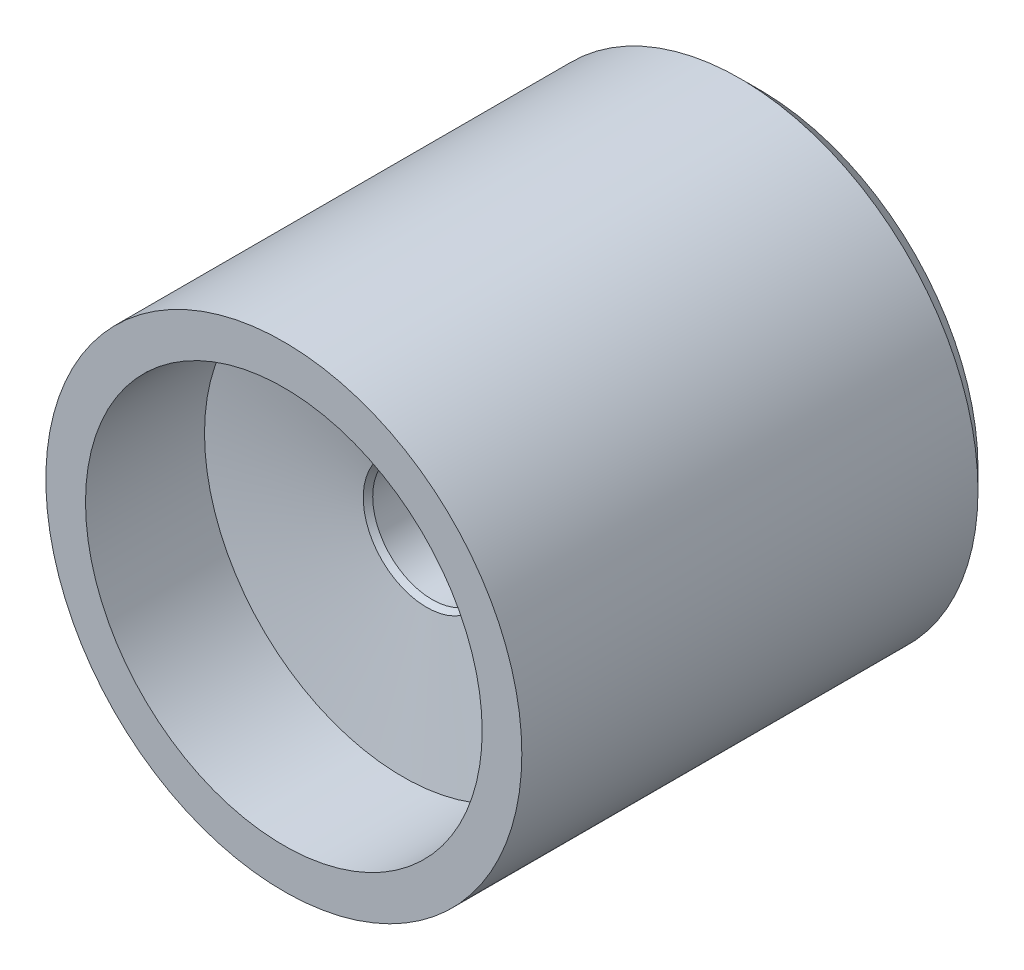
from build123d import *

# Parameters (mm, degrees)
SKETCH2_R           = 6
BOSS_EXTRUDE1_DEPTH = 12
CHAMFER1_SIZE       = 0.1
CHAMFER1_SIZE2      = 0.123280305
CHAMFER2_SIZE       = 0.5


with BuildPart() as part:
    # Sketch2 → Boss-Extrude1 (new body)
    with BuildSketch(Plane.XY):
        Circle(SKETCH2_R)
    extrude(amount=BOSS_EXTRUDE1_DEPTH)

    # Sketch3 → Cut-Revolve1 (revolve, cut)
    with BuildSketch(Plane(origin=(0, 0, 0), x_dir=(1, 0, 0), z_dir=(0, 1, 0))):
        Polygon((0, -12), (0, -3.5), (1.5, -3.5), (1.5, -8.382855568), (5, -9), (5, -12), align=None)
    revolve(axis=Axis((0, 0, 12), (0, 0, -1)), mode=Mode.SUBTRACT)

    # Chamfer1
    chamfer1_edges = [part.edges().sort_by_distance(p)[0] for p in [
        (-1.5, 0, 8.382855568),
    ]]
    chamfer1_side = [part.faces().sort_by_distance(p)[0] for p in [
        (-3.25, 0, 8.691427784),
    ]]
    chamfer(chamfer1_edges, length=CHAMFER1_SIZE, length2=CHAMFER1_SIZE2, reference=chamfer1_side[0])

    # Chamfer2
    chamfer2_edges = [part.edges().sort_by_distance(p)[0] for p in [
        (-6, 0, 0),
    ]]
    chamfer(chamfer2_edges, length=CHAMFER2_SIZE)


solid = part.part
